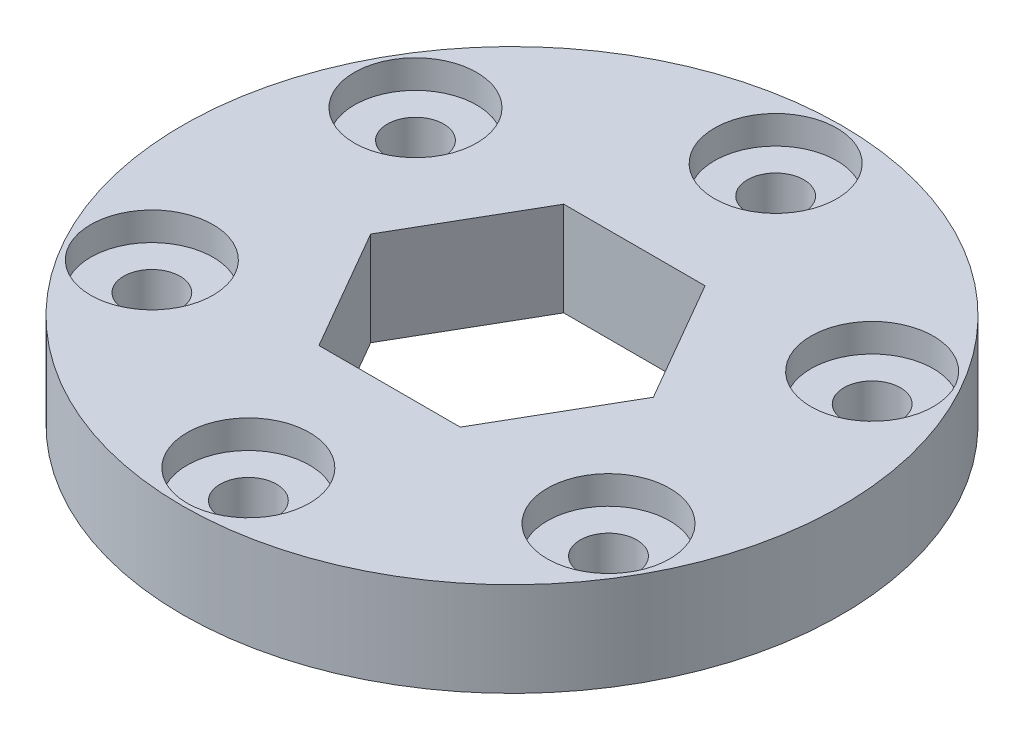
from build123d import *

# Parameters (mm, degrees)
SKETCH1_R           = 17.5
SKETCH1_R_2         = 1.5
BOSS_EXTRUDE1_DEPTH = 5
SKETCH2_R           = 3.25
CUT_EXTRUDE1_DEPTH  = 1.5


with BuildPart() as part:
    # Sketch1 → Boss-Extrude1 (new body)
    with BuildSketch(Plane(origin=(0, 0, 0), x_dir=(1, 0, 0), z_dir=(0, 1, 0))):
        with Locations(Location((0, 0, 0), (0, 0, 270))):
            Circle(SKETCH1_R)
        with Locations(Location((0, 14, 0), (0, 0, 270))):
            Circle(SKETCH1_R_2, mode=Mode.SUBTRACT)
        with Locations(Location((12.124355653, 7, 0), (0, 0, 270))):
            Circle(SKETCH1_R_2, mode=Mode.SUBTRACT)
        with Locations(Location((12.124355653, -7, 0), (0, 0, 270))):
            Circle(SKETCH1_R_2, mode=Mode.SUBTRACT)
        with Locations(Location((0, -14, 0), (0, 0, 270))):
            Circle(SKETCH1_R_2, mode=Mode.SUBTRACT)
        with Locations(Location((-12.124355653, -7, 0), (0, 0, 270))):
            Circle(SKETCH1_R_2, mode=Mode.SUBTRACT)
        with Locations(Location((-12.124355653, 7, 0), (0, 0, 270))):
            Circle(SKETCH1_R_2, mode=Mode.SUBTRACT)
        Polygon((7.505553499, 0), (3.75277675, 6.5), (-3.75277675, 6.5), (-7.505553499, 0), (-3.75277675, -6.5), (3.75277675, -6.5), align=None, mode=Mode.SUBTRACT)
    extrude(amount=BOSS_EXTRUDE1_DEPTH)

    # Sketch2 → Cut-Extrude1 (cut)
    with BuildSketch(Plane(origin=(0, 5, 0), x_dir=(1, 0, 0), z_dir=(0, 1, 0))):
        with Locations(Location((0, 14, 0), (0, 0, 270))):
            Circle(SKETCH2_R)
        with Locations(Location((12.124355653, 7, 0), (0, 0, 270))):
            Circle(SKETCH2_R)
        with Locations(Location((12.124355653, -7, 0), (0, 0, 270))):
            Circle(SKETCH2_R)
        with Locations(Location((0, -14, 0), (0, 0, 270))):
            Circle(SKETCH2_R)
        with Locations(Location((-12.124355653, -7, 0), (0, 0, 270))):
            Circle(SKETCH2_R)
        with Locations(Location((-12.124355653, 7, 0), (0, 0, 270))):
            Circle(SKETCH2_R)
    extrude(amount=-CUT_EXTRUDE1_DEPTH, mode=Mode.SUBTRACT)


solid = part.part
